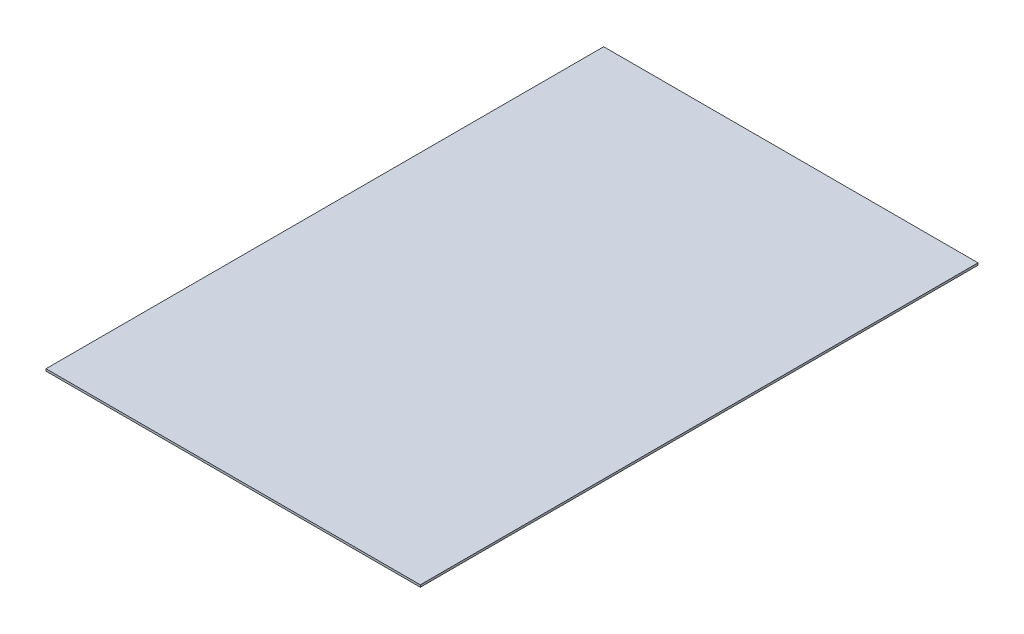
from build123d import *

# Parameters (mm, degrees)
CROQUIS1_W              = 349
CROQUIS1_H              = 520
SALIENTE_EXTRUIR1_DEPTH = 2


with BuildPart() as part:
    # Croquis1 → Saliente-Extruir1 (new body)
    with BuildSketch(Plane(origin=(0, 0, 0), x_dir=(1, 0, 0), z_dir=(0, 1, 0))):
        Rectangle(CROQUIS1_W, CROQUIS1_H)
    extrude(amount=SALIENTE_EXTRUIR1_DEPTH)


solid = part.part
